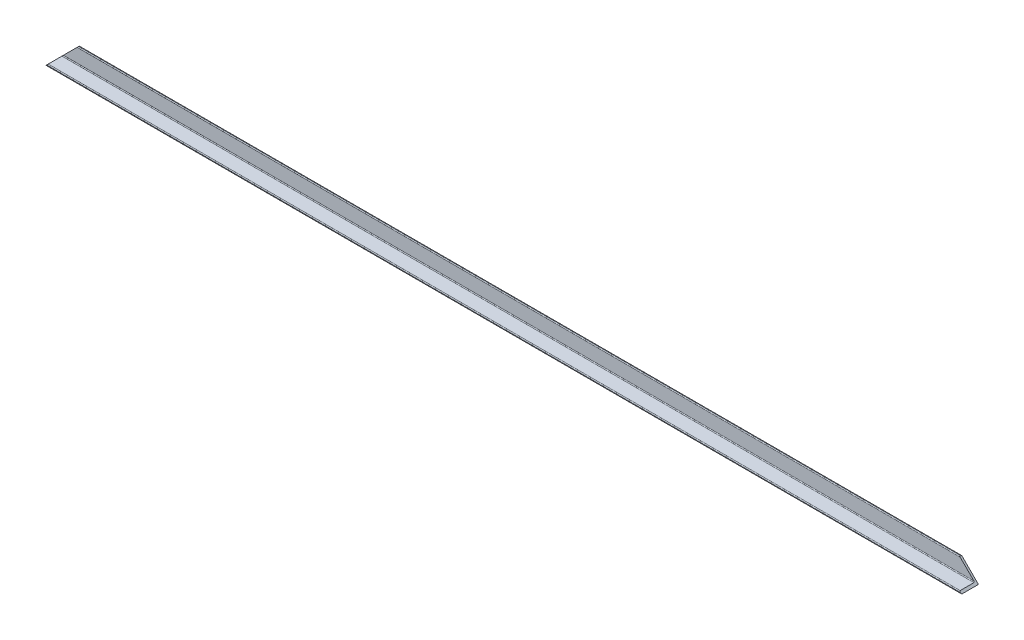
from build123d import *

# Parameters (mm, degrees)
SKETCH1_W               = 1220
SKETCH1_H               = 22.5
BOSS_EXTRUDE1_DEPTH     = 2.5
SKETCH2_W               = 1220
SKETCH2_H               = 2.5
BOSS_EXTRUDE2_DEPTH     = 20
CUT_EXTRUDE1_DEPTH      = 611.742376129
CUT_EXTRUDE1_DEPTH_BACK = 25
FILLET2_R               = 1


with BuildPart() as part:
    # Sketch1 → Boss-Extrude1 (new body)
    with BuildSketch(Plane(origin=(0, 0, 0), x_dir=(1, 0, 0), z_dir=(0, 1, 0))):
        Rectangle(SKETCH1_W, SKETCH1_H)
    extrude(amount=BOSS_EXTRUDE1_DEPTH)

    # Sketch2 → Boss-Extrude2 (add)
    with BuildSketch(Plane(origin=(0, 2.5, 0), x_dir=(1, 0, 0), z_dir=(0, 1, 0))):
        with Locations((0, 10)):
            Rectangle(SKETCH2_W, SKETCH2_H)
    extrude(amount=BOSS_EXTRUDE2_DEPTH)

    # Sketch3 → Cut-Extrude1 (cut, two sides: drawn at the far end of the back side and taken through both)
    with BuildSketch(Plane.XY.offset(-8.75).offset(-CUT_EXTRUDE1_DEPTH_BACK)):
        Polygon((-610, 22.5), (-610, -7.5), (-580, 22.5), align=None)
        Polygon((610, 22.5), (610, -7.5), (580, 22.5), align=None)
    extrude(amount=CUT_EXTRUDE1_DEPTH + CUT_EXTRUDE1_DEPTH_BACK, mode=Mode.SUBTRACT)

    # Fillet2
    fillet2_edges = [part.edges().sort_by_distance(p)[0] for p in [
        (0, 22.5, -8.75),
        (0, 2.5, -8.75),
        (0, 0, 11.25),
        (0, 2.5, 11.25),
        (0, 22.5, -11.25),
        (0, 0, -11.25),
    ]]
    fillet(fillet2_edges, radius=FILLET2_R)


solid = part.part
